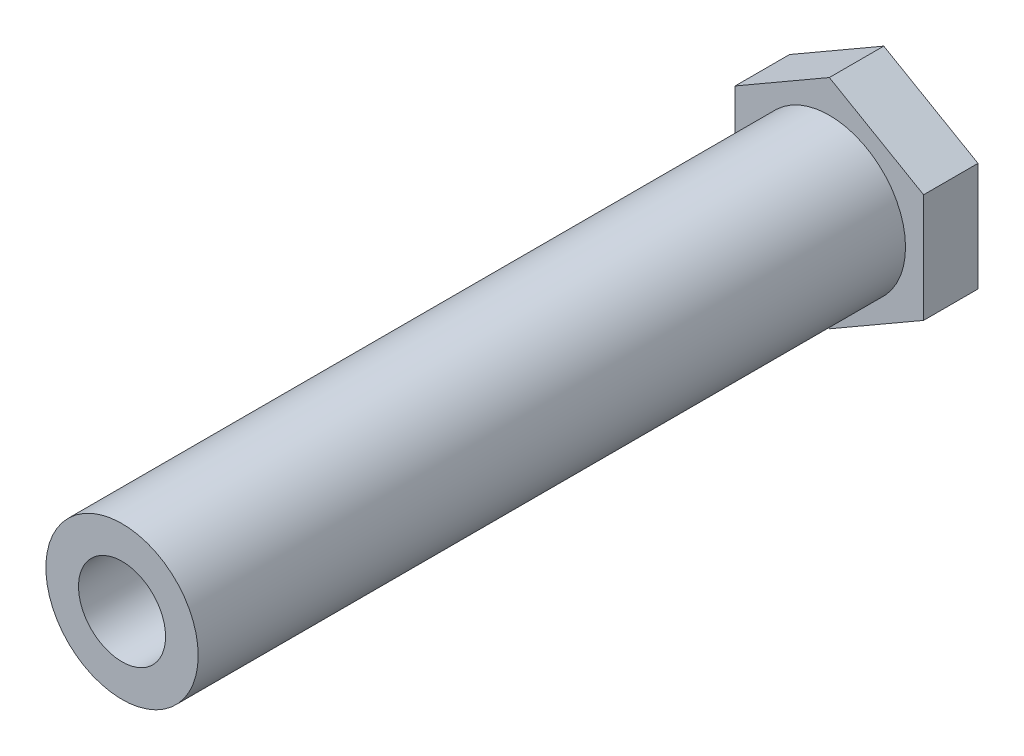
from build123d import *

# Parameters (mm, degrees)
BOSS_EXTRUDE1_DEPTH = 5
SKETCH2_R           = 7
BOSS_EXTRUDE2_DEPTH = 65
SKETCH3_R           = 4
CUT_EXTRUDE1_DEPTH  = 20


with BuildPart() as part:
    # Sketch1 → Boss-Extrude1 (new body)
    with BuildSketch(Plane.XY):
        Polygon((8.660254038, -5), (8.660254038, 5), (0, 10), (-8.660254038, 5), (-8.660254038, -5), (0, -10), align=None)
    extrude(amount=BOSS_EXTRUDE1_DEPTH)

    # Sketch2 → Boss-Extrude2 (add)
    with BuildSketch(Plane.XY.offset(5)):
        Circle(SKETCH2_R)
    extrude(amount=BOSS_EXTRUDE2_DEPTH)

    # Sketch3 → Cut-Extrude1 (cut)
    with BuildSketch(Plane.XY.offset(70)):
        Circle(SKETCH3_R)
    extrude(amount=-CUT_EXTRUDE1_DEPTH, mode=Mode.SUBTRACT)


solid = part.part
